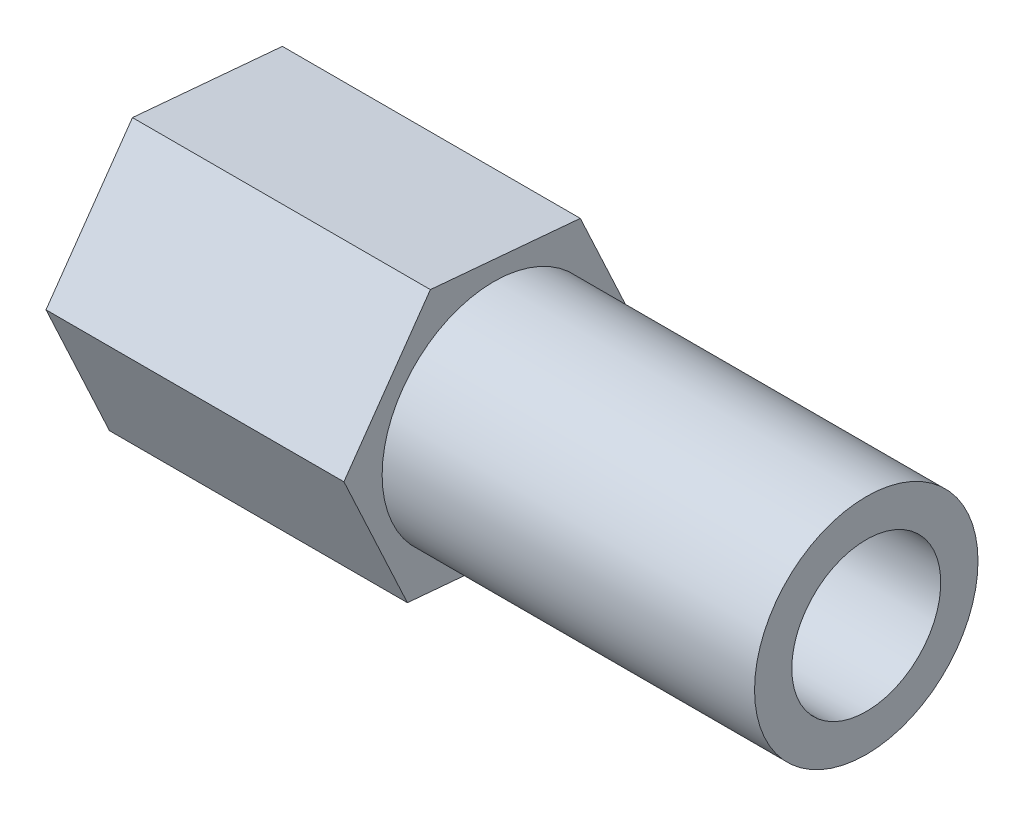
from build123d import *

# Parameters (mm, degrees)
EXTRUDE_1_DEPTH     = 8
SKETCH_2_R          = 3
EXTRUDE_2_DEPTH     = 10
SKETCH_3_R          = 2
CUT_EXTRUDE_1_DEPTH = 19.805177909
SKETCH_4_R          = 1.5
CUT_EXTRUDE_2_DEPTH = 10


with BuildPart() as part:
    # 草图1 → 凸台-拉伸1 (new body)
    with BuildSketch(Plane(origin=(0, 0, 0), x_dir=(0, 0, -1), z_dir=(1, 0, 0))):
        Polygon((1.704440109, -3.664453199), (4.025729616, -0.356138166), (2.321289507, 3.308315033), (-1.704440109, 3.664453199), (-4.025729616, 0.356138166), (-2.321289507, -3.308315033), align=None)
    extrude(amount=EXTRUDE_1_DEPTH)

    # 草图2 → 凸台-拉伸2 (add)
    with BuildSketch(Plane(origin=(8, 0, 0), x_dir=(0, 0, -1), z_dir=(1, 0, 0))):
        Circle(SKETCH_2_R)
    extrude(amount=EXTRUDE_2_DEPTH)

    # 草图3 → 切除-拉伸1 (cut, through all)
    with BuildSketch(Plane.ZY):
        Circle(SKETCH_3_R)
    extrude(amount=-CUT_EXTRUDE_1_DEPTH, mode=Mode.SUBTRACT)

    # 草图4 → 切除-拉伸2 (cut)
    with BuildSketch(Plane.XY):
        with Locations((13.078342884, 0)):
            Circle(SKETCH_4_R)
    extrude(amount=-CUT_EXTRUDE_2_DEPTH, mode=Mode.SUBTRACT)


solid = part.part
